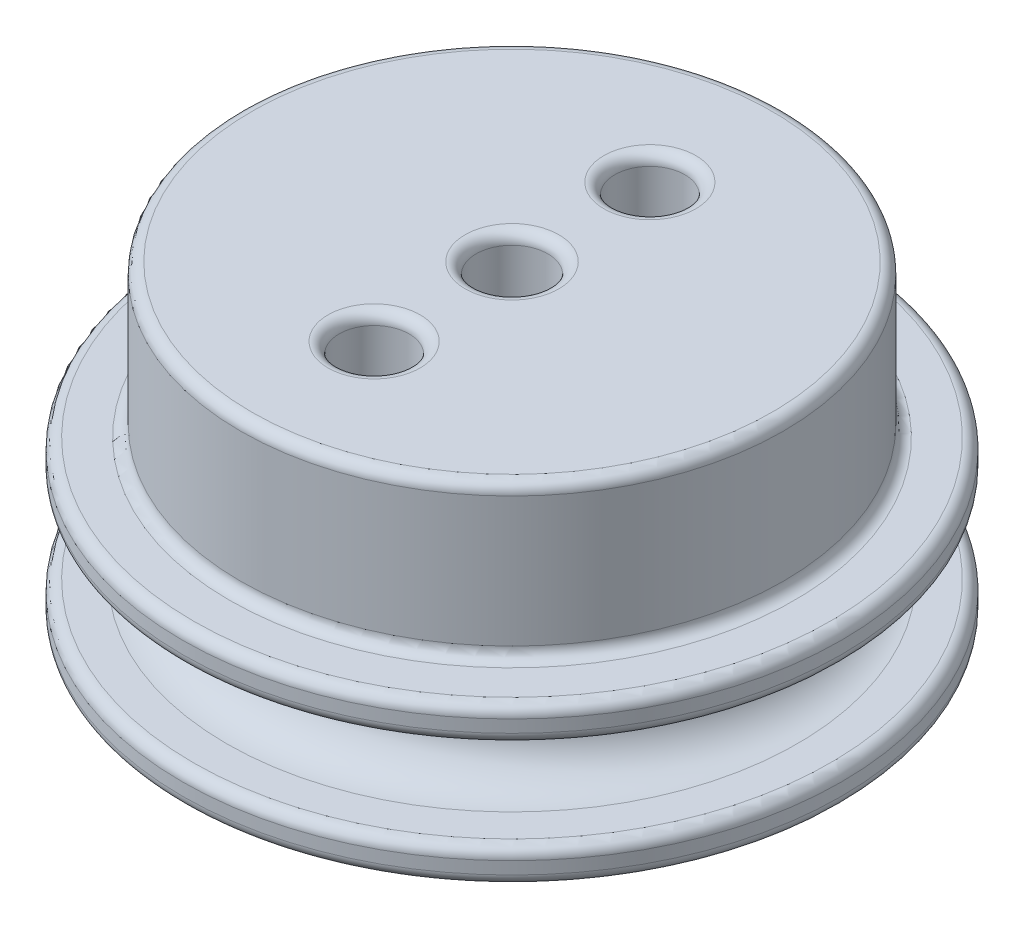
from build123d import *

# Parameters (mm, degrees)
SKETCH2_R          = 1.6129
SKETCH2_R_2        = 1.651
CUT_EXTRUDE1_DEPTH = 7.62
SKETCH3_R          = 2.921
CUT_EXTRUDE2_DEPTH = 23.775353005
FILLET1_R          = 0.508


with BuildPart() as part:
    # Sketch1 → Revolve1 (revolve)
    with BuildSketch(Plane.XY):
        with BuildLine():
            Line((-15.1765, -3.6195), (0, -3.6195))
            Line((0, -3.6195), (0, 10.6195))
            Line((0, 10.6195), (-12.500000019, 10.6195))
            Line((-12.500000019, 10.6195), (-12.500000019, 3.6195))
            Line((-12.500000019, 3.6195), (-15.1765, 3.6195))
            Line((-15.1765, 3.6195), (-15.1765, 2.032))
            Line((-15.1765, 2.032), (-13.1445, 2.032))
            ThreePointArc((-13.1445, 2.032), (-11.1125, 0), (-13.1445, -2.032))
            Line((-13.1445, -2.032), (-15.1765, -2.032))
            Line((-15.1765, -2.032), (-15.1765, -3.6195))
        make_face()
    revolve(axis=Axis((0, 10.6195, 0), (0, -1, 0)))

    # Sketch2 → Cut-Extrude1 (cut)
    with BuildSketch(Plane(origin=(0, 10.6195, 0), x_dir=(1, 0, 0), z_dir=(0, 1, 0))):
        with Locations((0, 6.35)):
            Circle(SKETCH2_R)
        Circle(SKETCH2_R_2)
        with Locations((0, -6.35)):
            Circle(SKETCH2_R)
    extrude(amount=-CUT_EXTRUDE1_DEPTH, mode=Mode.SUBTRACT)

    # Sketch3 → Cut-Extrude2 (cut, through all)
    with BuildSketch(Plane(origin=(0, 2.9995, 0), x_dir=(1, 0, 0), z_dir=(0, 1, 0))):
        Circle(SKETCH3_R)
    extrude(amount=-CUT_EXTRUDE2_DEPTH, mode=Mode.SUBTRACT)

    # Fillet1
    fillet1_edges = [part.edges().sort_by_distance(p)[0] for p in [
        (12.500000019, 10.6195, 0),
        (-1.6129, 10.6195, 6.35),
        (-1.651, 10.6195, 0),
        (-1.6129, 10.6195, -6.35),
        (12.500000019, 3.6195, 0),
        (15.1765, 3.6195, 0),
        (15.1765, -3.6195, 0),
        (-2.921, -3.6195, 0),
        (15.1765, -2.032, 0),
        (15.1765, 2.032, 0),
    ]]
    fillet(fillet1_edges, radius=FILLET1_R)


solid = part.part
